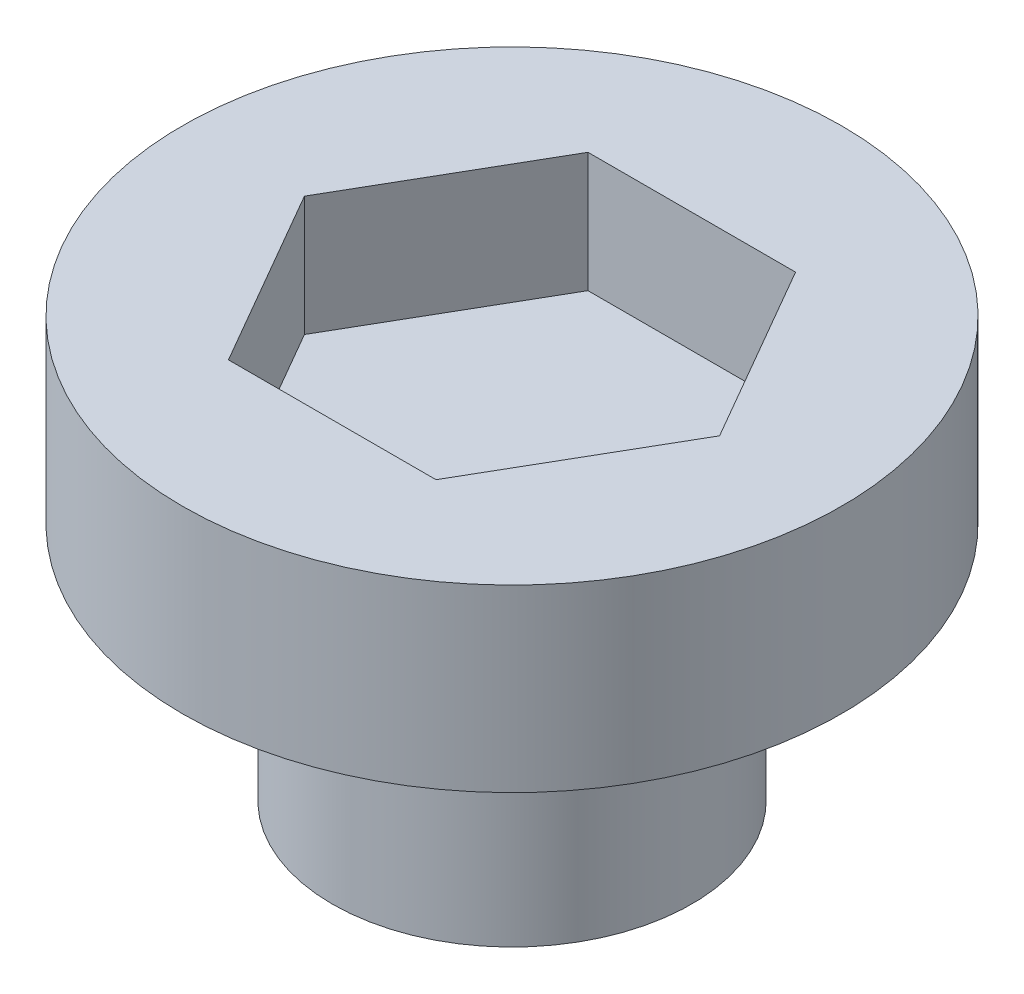
from build123d import *

# Parameters (mm, degrees)
SKETCH1_W          = 1.5
SKETCH1_H          = 2
CUT_EXTRUDE1_DEPTH = 1


with BuildPart() as part:
    # Sketch1 → Revolve1 (revolve)
    with BuildSketch(Plane.XY, mode=Mode.PRIVATE) as revolve1_sk:
        Polygon((0, 3.5), (0, 2), (1.5, 2), (2.75, 2), (2.75, 3.5), align=None)
        with Locations((0.75, 1)):
            Rectangle(SKETCH1_W, SKETCH1_H)
    revolve(revolve1_sk.sketch.rotate(Axis((0, 0, 0), (0, 1, 0)), 90), axis=Axis((0, 0, 0), (0, 1, 0)))

    # Sketch2 → Cut-Extrude1 (cut)
    with BuildSketch(Plane(origin=(0, 3.5, 0), x_dir=(1, 0, 0), z_dir=(0, 1, 0))):
        Polygon((-1.732050808, 0), (-0.866025404, -1.5), (0.866025404, -1.5), (1.732050808, 0), (0.866025404, 1.5), (-0.866025404, 1.5), align=None)
    extrude(amount=-CUT_EXTRUDE1_DEPTH, mode=Mode.SUBTRACT)


solid = part.part
